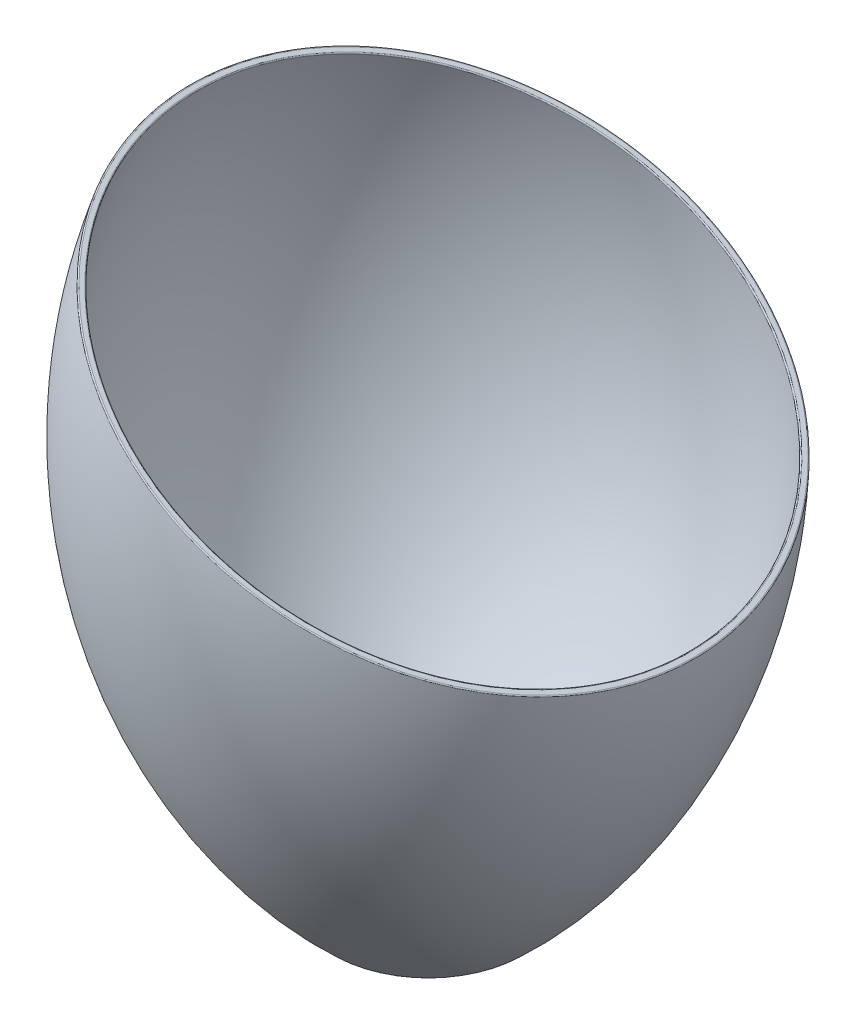
from build123d import *

# Parameters (mm, degrees)
CUT_EXTRUDE1_DEPTH      = 338.983422559
CUT_EXTRUDE1_DEPTH_BACK = 338.983422559
FILLET1_R               = 0.5


with BuildPart() as part:
    # Sketch1 → Revolve1 (revolve)
    with BuildSketch(Plane.XY, mode=Mode.PRIVATE) as revolve1_sk:
        with BuildLine():
            Line((0, 0), (36.117150658, 0))
            ThreePointArc((36.117150658, 0), (39.774012725, 0.692617993), (42.924313098, 2.674528035))
            ThreePointArc((42.924313098, 2.674528035), (117.954121887, 137.101880747), (100, 290))
            Line((100, 290), (97.272943025, 288.749735926))
            ThreePointArc((97.272943025, 288.749735926), (117.197047033, 150.42319432), (58.863231808, 23.425682399))
            ThreePointArc((58.863231808, 23.425682399), (55.466739499, 20.896616672), (51.328090928, 20))
            Line((51.328090928, 20), (0, 20))
            Line((0, 20), (0, 0))
        make_face()
    revolve(revolve1_sk.sketch.rotate(Axis((0, 0, 0), (0, 1, 0)), 90), axis=Axis((0, 0, 0), (0, 1, 0)))

    # Sketch2 → Cut-Extrude1 (cut, two sides: drawn at the far end of the back side and taken through both)
    with BuildSketch(Plane.XY.offset(-CUT_EXTRUDE1_DEPTH_BACK)):
        Polygon((-157.125751205, 294.917911765), (140, 150), (140, 294.917911765), align=None)
    extrude(amount=CUT_EXTRUDE1_DEPTH + CUT_EXTRUDE1_DEPTH_BACK, mode=Mode.SUBTRACT)

    # Fillet1
    fillet1_edges = [part.edges().sort_by_distance(p)[0] for p in [
        (13.600811506, 211.649003397, 120.642261754),
        (13.44215441, 211.726385633, 117.616348156),
    ]]
    fillet(fillet1_edges, radius=FILLET1_R)


solid = part.part
